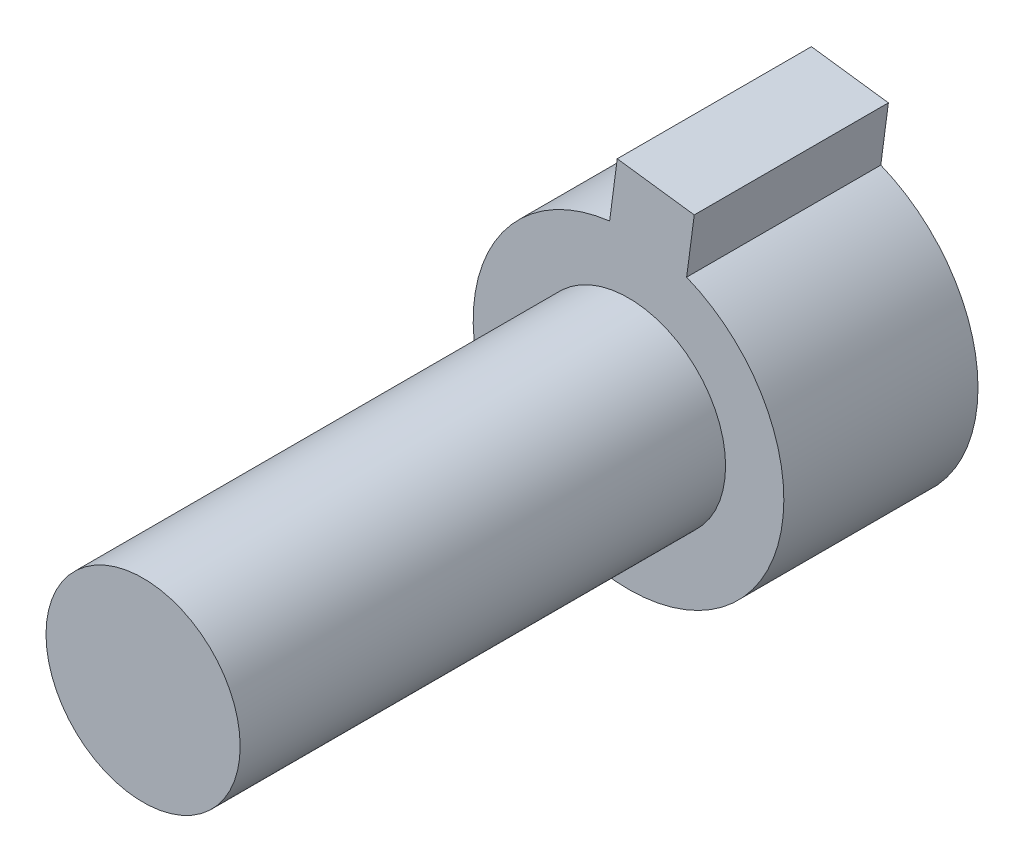
from build123d import *

# Parameters (mm, degrees)
BOSS_EXTRUDE1_DEPTH = 10
SKETCH2_R           = 5
BOSS_EXTRUDE2_DEPTH = 25


with BuildPart() as part:
    # Sketch1 → Boss-Extrude1 (new body)
    with BuildSketch(Plane.XY):
        with BuildLine():
            Line((-0.580259609, 10.915085842), (3.385519837, 10.392981073))
            Line((3.385519837, 10.392981073), (2.99394126, 7.418646489))
            ThreePointArc((2.99394126, 7.418646489), (-1.044209538, -7.931558891), (-0.971838185, 7.940751258))
            Line((-0.971838185, 7.940751258), (-0.580259609, 10.915085842))
        make_face()
    extrude(amount=BOSS_EXTRUDE1_DEPTH)

    # Sketch2 → Boss-Extrude2 (add)
    with BuildSketch(Plane.XY.offset(10)):
        Circle(SKETCH2_R)
    extrude(amount=BOSS_EXTRUDE2_DEPTH)


solid = part.part
